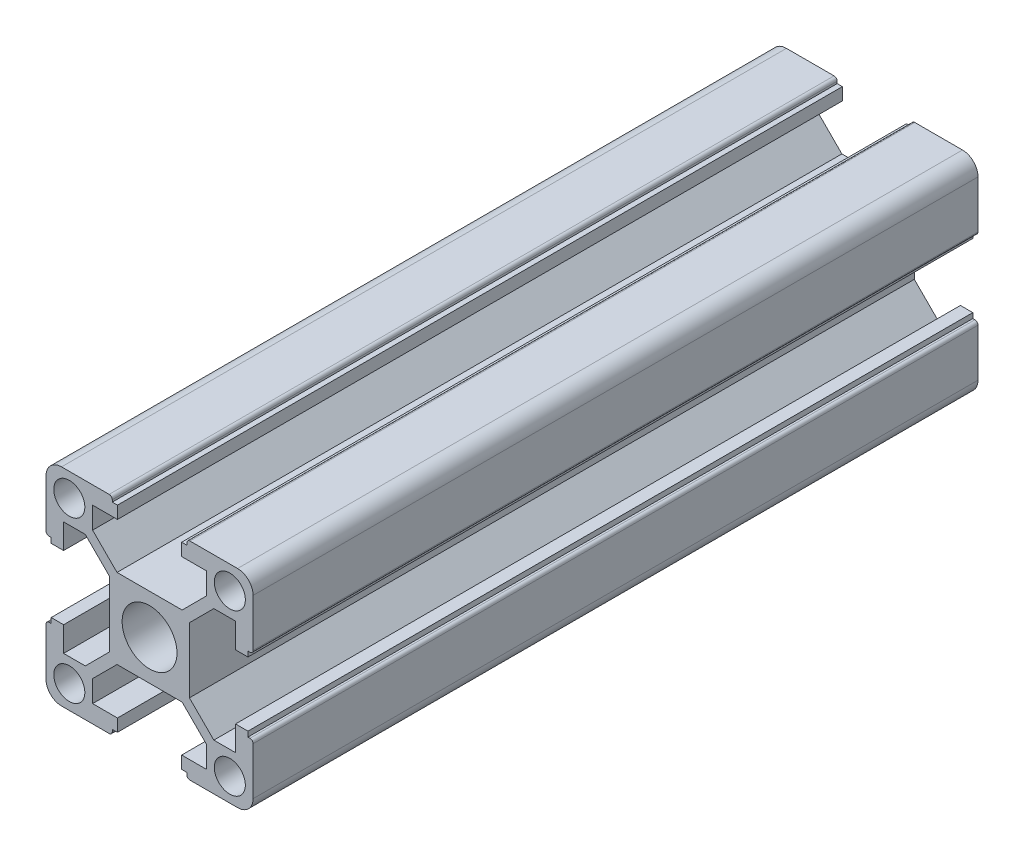
from build123d import *

# Parameters (mm, degrees)
SKETCH_1_R               = 2.65
SKETCH_1_R_2             = 1.5
EXTRUDE_1_DEPTH          = 35
CUT_EXTRUDE_3_DEPTH      = 38.749172176
CUT_EXTRUDE_3_DEPTH_BACK = 38.749172176
SKETCH_5_R               = 2
SKETCH_6_R               = 4.25
CUT_EXTRUDE_4_DEPTH      = 39.946405572


with BuildPart() as part:
    # 草图1 → 凸台-拉伸1 (new, symmetric)
    with BuildSketch(Plane.XY):
        with BuildLine():
            Line((3.142893219, 3.85), (-3.142893219, 3.85))
            Line((-3.142893219, 3.85), (-5.5, 6.207106781))
            Line((-5.5, 6.207106781), (-5.5, 8.3))
            Line((-5.5, 8.3), (-3.1, 8.3))
            Line((-3.1, 8.3), (-3.1, 9.5))
            Line((-3.1, 9.5), (-3.6, 9.5))
            Line((-3.6, 9.5), (-3.6, 9.7))
            ThreePointArc((-3.6, 9.7), (-3.687867966, 9.912132034), (-3.9, 10))
            Line((-3.9, 10), (-8.5, 10))
            ThreePointArc((-8.5, 10), (-9.560660172, 9.560660172), (-10, 8.5))
            Line((-10, 8.5), (-10, 3.9))
            ThreePointArc((-10, 3.9), (-9.912132034, 3.687867966), (-9.7, 3.6))
            Line((-9.7, 3.6), (-9.5, 3.6))
            Line((-9.5, 3.6), (-9.5, 3.1))
            Line((-9.5, 3.1), (-8.3, 3.1))
            Line((-8.3, 3.1), (-8.3, 5.5))
            Line((-8.3, 5.5), (-6.207106781, 5.5))
            Line((-6.207106781, 5.5), (-3.85, 3.142893219))
            Line((-3.85, 3.142893219), (-3.85, -3.142893219))
            Line((-3.85, -3.142893219), (-6.207106781, -5.5))
            Line((-6.207106781, -5.5), (-8.3, -5.5))
            Line((-8.3, -5.5), (-8.3, -3.1))
            Line((-8.3, -3.1), (-9.5, -3.1))
            Line((-9.5, -3.1), (-9.5, -3.6))
            Line((-9.5, -3.6), (-9.7, -3.6))
            ThreePointArc((-9.7, -3.6), (-9.912132034, -3.687867966), (-10, -3.9))
            Line((-10, -3.9), (-10, -8.5))
            ThreePointArc((-10, -8.5), (-9.560660172, -9.560660172), (-8.5, -10))
            Line((-8.5, -10), (-3.9, -10))
            ThreePointArc((-3.9, -10), (-3.687867966, -9.912132034), (-3.6, -9.7))
            Line((-3.6, -9.7), (-3.6, -9.5))
            Line((-3.6, -9.5), (-3.1, -9.5))
            Line((-3.1, -9.5), (-3.1, -8.3))
            Line((-3.1, -8.3), (-5.5, -8.3))
            Line((-5.5, -8.3), (-5.5, -6.207106781))
            Line((-5.5, -6.207106781), (-3.142893219, -3.85))
            Line((-3.142893219, -3.85), (3.142893219, -3.85))
            Line((3.142893219, -3.85), (5.5, -6.207106781))
            Line((5.5, -6.207106781), (5.5, -8.3))
            Line((5.5, -8.3), (3.1, -8.3))
            Line((3.1, -8.3), (3.1, -9.5))
            Line((3.1, -9.5), (3.6, -9.5))
            Line((3.6, -9.5), (3.6, -9.7))
            ThreePointArc((3.6, -9.7), (3.687867966, -9.912132034), (3.9, -10))
            Line((3.9, -10), (8.5, -10))
            ThreePointArc((8.5, -10), (9.560660172, -9.560660172), (10, -8.5))
            Line((10, -8.5), (10, -3.9))
            ThreePointArc((10, -3.9), (9.912132034, -3.687867966), (9.7, -3.6))
            Line((9.7, -3.6), (9.5, -3.6))
            Line((9.5, -3.6), (9.5, -3.1))
            Line((9.5, -3.1), (8.3, -3.1))
            Line((8.3, -3.1), (8.3, -5.5))
            Line((8.3, -5.5), (6.207106781, -5.5))
            Line((6.207106781, -5.5), (3.85, -3.142893219))
            Line((3.85, -3.142893219), (3.85, 3.142893219))
            Line((3.85, 3.142893219), (6.207106781, 5.5))
            Line((6.207106781, 5.5), (8.3, 5.5))
            Line((8.3, 5.5), (8.3, 3.1))
            Line((8.3, 3.1), (9.5, 3.1))
            Line((9.5, 3.1), (9.5, 3.6))
            Line((9.5, 3.6), (9.7, 3.6))
            ThreePointArc((9.7, 3.6), (9.912132034, 3.687867966), (10, 3.9))
            Line((10, 3.9), (10, 8.5))
            ThreePointArc((10, 8.5), (9.560660172, 9.560660172), (8.5, 10))
            Line((8.5, 10), (3.9, 10))
            ThreePointArc((3.9, 10), (3.687867966, 9.912132034), (3.6, 9.7))
            Line((3.6, 9.7), (3.6, 9.5))
            Line((3.6, 9.5), (3.1, 9.5))
            Line((3.1, 9.5), (3.1, 8.3))
            Line((3.1, 8.3), (5.5, 8.3))
            Line((5.5, 8.3), (5.5, 6.207106781))
            Line((5.5, 6.207106781), (3.142893219, 3.85))
        make_face()
        Circle(SKETCH_1_R, mode=Mode.SUBTRACT)
        with Locations((-7.75, 7.75)):
            Circle(SKETCH_1_R_2, mode=Mode.SUBTRACT)
        with Locations((7.75, 7.75)):
            Circle(SKETCH_1_R_2, mode=Mode.SUBTRACT)
        with Locations((7.75, -7.75)):
            Circle(SKETCH_1_R_2, mode=Mode.SUBTRACT)
        with Locations((-7.75, -7.75)):
            Circle(SKETCH_1_R_2, mode=Mode.SUBTRACT)
    extrude(amount=EXTRUDE_1_DEPTH, both=True)

    # 草图5 → 切除-拉伸3 (cut, two sides: drawn at the far end of the back side and taken through both)
    with BuildSketch(Plane(origin=(0, 0, 0), x_dir=(0, 0, -1), z_dir=(1, 0, 0)).offset(-CUT_EXTRUDE_3_DEPTH_BACK)):
        with Locations(Location((25, 0, 0), (0, 0, 180))):
            Circle(SKETCH_5_R)
    extrude(amount=CUT_EXTRUDE_3_DEPTH + CUT_EXTRUDE_3_DEPTH_BACK, mode=Mode.SUBTRACT)

    # 草图6 → 切除-拉伸4 (cut, through all)
    with BuildSketch(Plane.ZY.offset(3.85)):
        with Locations((-25, 0)):
            Circle(SKETCH_6_R)
    extrude(amount=CUT_EXTRUDE_4_DEPTH, mode=Mode.SUBTRACT)


solid = part.part
